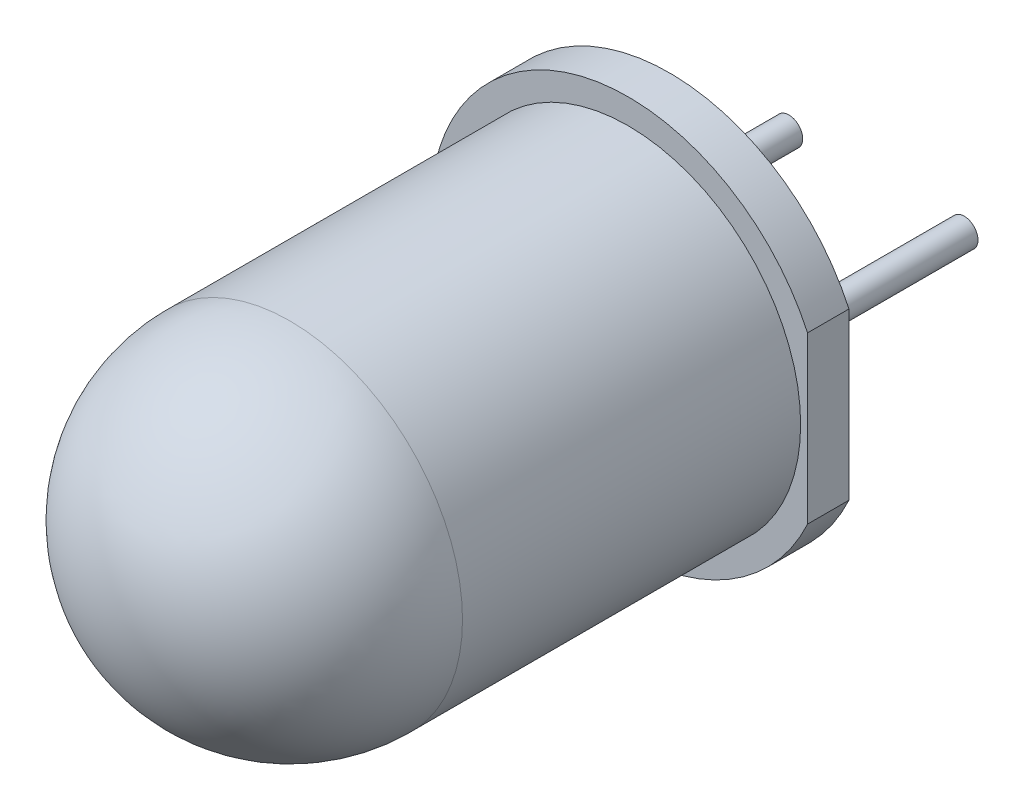
from build123d import *

# Parameters (mm, degrees)
EXTRUDE_1_DEPTH = 0.6
SKETCH_2_R      = 2.5
EXTRUDE_2_DEPTH = 7.4
FILLET_1_R      = 2.5
SKETCH_3_R      = 0.2
EXTRUDE_3_DEPTH = 3


with BuildPart() as part:
    # 草图1 → 凸台-拉伸1 (new body)
    with BuildSketch(Plane.XY):
        with BuildLine():
            Line((2.6, 1.2), (2.6, -1.2))
            ThreePointArc((2.6, -1.2), (-2.863564213, 0), (2.6, 1.2))
        make_face()
    extrude(amount=EXTRUDE_1_DEPTH)

    # 草图2 → 凸台-拉伸2 (add)
    with BuildSketch(Plane.XY.offset(0.6)):
        Circle(SKETCH_2_R)
    extrude(amount=EXTRUDE_2_DEPTH)

    # 圆角1
    fillet_1_edges = [part.edges().sort_by_distance(p)[0] for p in [
        (-2.5, 0, 8),
    ]]
    fillet(fillet_1_edges, radius=FILLET_1_R)

    # 草图3 → 凸台-拉伸3 (add)
    with BuildSketch(Plane(origin=(0, 0, 0), x_dir=(-1, 0, 0), z_dir=(0, 0, -1))):
        with Locations(Location((1.27, 0, 0), (0, 0, 180))):
            Circle(SKETCH_3_R)
        with Locations(Location((-1.27, 0, 0), (0, 0, 180))):
            Circle(SKETCH_3_R)
    extrude(amount=EXTRUDE_3_DEPTH)


solid = part.part
